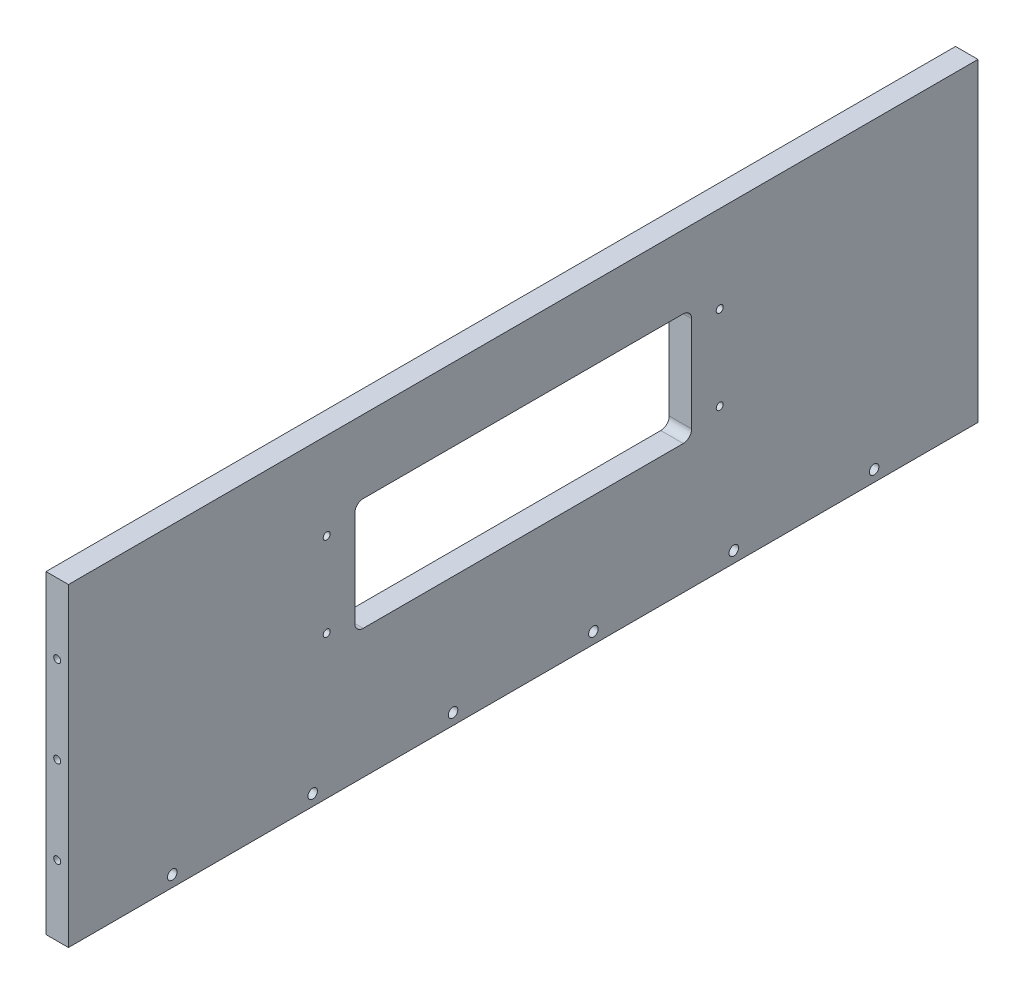
from build123d import *

# Parameters (mm, degrees)
SKETCH1_W                                     = 324
SKETCH1_H                                     = 112
BOSS_EXTRUDE1_DEPTH                           = 8
M3X0_5_TAPPED_HOLE1_AT_2_COUNT                = 2
M3X0_5_TAPPED_HOLE1_AT_2_PITCH                = 31
M3X0_5_TAPPED_HOLE1_AT_3_COUNT                = 2
M3X0_5_TAPPED_HOLE1_AT_3_PITCH                = 62
CSK_FOR_M3_COUNTERSUNK_FLAT_HEAD1_D           = 3.4
CSK_FOR_M3_COUNTERSUNK_FLAT_HEAD1_DEPTH       = 11.5
CSK_FOR_M3_COUNTERSUNK_FLAT_HEAD1_CSINK_D     = 6.3
CSK_FOR_M3_COUNTERSUNK_FLAT_HEAD1_CSINK_ANGLE = 90
CSK_FOR_M3_COUNTERSUNK_FLAT_HEAD1_TIP         = 1.021463052
SKETCH9_W                                     = 120
SKETCH9_H                                     = 40
CUT_EXTRUDE1_DEPTH                            = 172.59254063
M3X0_5_TAPPED_HOLE2_D                         = 2.5
FILLET1_R                                     = 3


with BuildPart() as part:
    # Sketch1 → Boss-Extrude1 (new body)
    with BuildSketch(Plane(origin=(0, 0, 0), x_dir=(0, 0, -1), z_dir=(1, 0, 0))):
        Rectangle(SKETCH1_W, SKETCH1_H)
    extrude(amount=BOSS_EXTRUDE1_DEPTH)

    # Sketch4 → M3x0.5 Tapped Hole1 (revolve, cut)
    with BuildSketch(Plane(origin=(4, 31, 162), x_dir=(0, -1, 0), z_dir=(1, 0, 0))):
        Polygon((0, 0), (0, 12.251075774), (1.25, 11.5), (1.25, 0), align=None)
    m3x0_5_tapped_hole1 = revolve(axis=Axis((4, 31, 168.35), (0, 0, -1)), mode=Mode.SUBTRACT)

    # M3x0.5 Tapped Hole1 at 2: M3x0.5 Tapped Hole1 ×2
    with Locations(*[(0, -i * M3X0_5_TAPPED_HOLE1_AT_2_PITCH, 0) for i in range(1, M3X0_5_TAPPED_HOLE1_AT_2_COUNT)]):
        add(m3x0_5_tapped_hole1, mode=Mode.SUBTRACT)

    # M3x0.5 Tapped Hole1 at 3: M3x0.5 Tapped Hole1 ×2
    with Locations(*[(0, -i * M3X0_5_TAPPED_HOLE1_AT_3_PITCH, 0) for i in range(1, M3X0_5_TAPPED_HOLE1_AT_3_COUNT)]):
        add(m3x0_5_tapped_hole1, mode=Mode.SUBTRACT)

    # Mirror1: M3x0.5 Tapped Hole1 across plane
    add(m3x0_5_tapped_hole1.mirror(Plane.XY), mode=Mode.SUBTRACT)

    # Mirror1 copy 1 sketch → Mirror1 copy 1 (revolve, cut)
    with BuildSketch(Plane(origin=(4, 0, -162), x_dir=(0, -1, 0), z_dir=(1, 0, 0))):
        Polygon((0, 0), (0, -12.251075774), (1.25, -11.5), (1.25, 0), align=None)
    revolve(axis=Axis((4, 0, -168.35), (0, 0, -1)), mode=Mode.SUBTRACT)

    # Mirror1 copy 2 sketch → Mirror1 copy 2 (revolve, cut)
    with BuildSketch(Plane(origin=(4, -31, -162), x_dir=(0, -1, 0), z_dir=(1, 0, 0))):
        Polygon((0, 0), (0, -12.251075774), (1.25, -11.5), (1.25, 0), align=None)
    revolve(axis=Axis((4, -31, -168.35), (0, 0, -1)), mode=Mode.SUBTRACT)

    # CSK for M3 Countersunk Flat Head1
    with Locations(Plane(origin=(0, -52, -125), x_dir=(0, 0, -1), z_dir=(-1, 0, 0))):
        with Locations((0, 0), (-50, 0), (-100, 0), (-150, 0), (-200, 0), (-250, 0)):
            CounterSinkHole(CSK_FOR_M3_COUNTERSUNK_FLAT_HEAD1_D / 2, CSK_FOR_M3_COUNTERSUNK_FLAT_HEAD1_CSINK_D / 2, depth=CSK_FOR_M3_COUNTERSUNK_FLAT_HEAD1_DEPTH, counter_sink_angle=CSK_FOR_M3_COUNTERSUNK_FLAT_HEAD1_CSINK_ANGLE)
            with Locations((0, 0, -(CSK_FOR_M3_COUNTERSUNK_FLAT_HEAD1_DEPTH + CSK_FOR_M3_COUNTERSUNK_FLAT_HEAD1_TIP / 2))):  # 118° drill point
                Cone(0, CSK_FOR_M3_COUNTERSUNK_FLAT_HEAD1_D / 2, CSK_FOR_M3_COUNTERSUNK_FLAT_HEAD1_TIP, mode=Mode.SUBTRACT)

    # Sketch9 → Cut-Extrude1 (cut, through all)
    with BuildSketch(Plane(origin=(8, 0, 0), x_dir=(0, 0, -1), z_dir=(1, 0, 0))):
        with Locations((0, 10)):
            Rectangle(SKETCH9_W, SKETCH9_H)
    extrude(amount=-CUT_EXTRUDE1_DEPTH, mode=Mode.SUBTRACT)

    # M3x0.5 Tapped Hole2 (through all)
    with Locations(Plane(origin=(8, 25, 70), x_dir=(0, 0, 1), z_dir=(1, 0, 0))):
        with Locations((0, 0), (0, 30)):
            m3x0_5_tapped_hole2 = Hole(M3X0_5_TAPPED_HOLE2_D / 2)

    # Mirror2: M3x0.5 Tapped Hole2 across plane
    add(m3x0_5_tapped_hole2.mirror(Plane.XY), mode=Mode.SUBTRACT)

    # Fillet1
    fillet1_edges = [part.edges().sort_by_distance(p)[0] for p in [
        (4, -10, 60),
        (4, 30, 60),
        (4, 30, -60),
        (4, -10, -60),
    ]]
    fillet(fillet1_edges, radius=FILLET1_R)


solid = part.part
